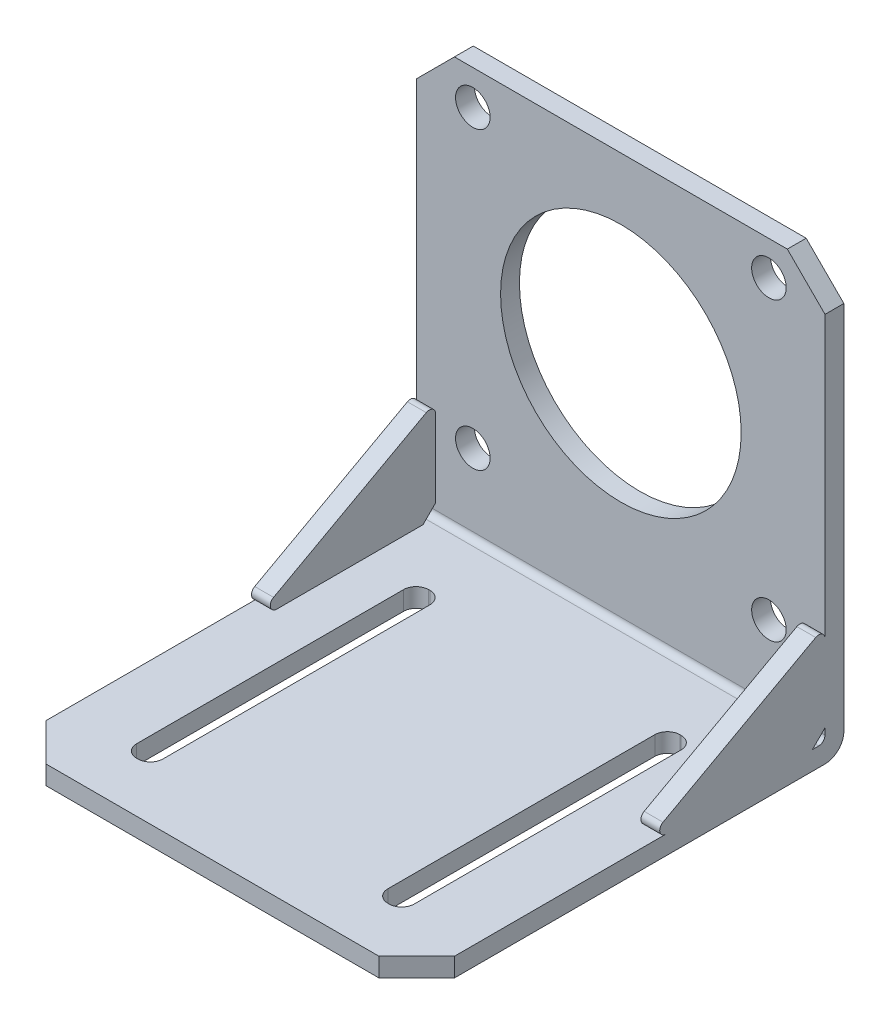
from build123d import *

# Parameters (mm, degrees)
SKETCH_1_W          = 65
SKETCH_1_H          = 65
EXTRUDE_1_DEPTH     = 3
SKETCH_1_3_W        = 65
SKETCH_1_3_H        = 3
EXTRUDE_2_DEPTH     = 68
CHAMFER_1_SIZE      = 6
CUT_EXTRUDE_1_REACH = 103.51
SKETCH_3_R          = 19.15
SKETCH_3_R_2        = 2.75
FILLET_1_R          = 3
FILLET_2_R          = 1
EXTRUDE_3_DEPTH     = 3
EXTRUDE_START       = -65
EXTRUDE_4_DEPTH     = 3


with BuildPart() as part:
    # Эскиз1 → Бобышка-Вытянуть1 (new body)
    with BuildSketch(Plane(origin=(0, 0, 0), x_dir=(1, 0, 0), z_dir=(0, 1, 0))):
        with Locations((0, -1.5)):
            Rectangle(SKETCH_1_W, SKETCH_1_H)
        with BuildLine():
            Line((-20.1, 20.5), (-19.9, 20.5))
            ThreePointArc((-19.9, 20.5), (-18.485786438, 19.914213562), (-17.9, 18.5))
            Line((-17.9, 18.5), (-17.9, -24))
            ThreePointArc((-17.9, -24), (-18.485786438, -25.414213562), (-19.9, -26))
            Line((-19.9, -26), (-20.1, -26))
            ThreePointArc((-20.1, -26), (-21.514213562, -25.414213562), (-22.1, -24))
            Line((-22.1, -24), (-22.1, 18.5))
            ThreePointArc((-22.1, 18.5), (-21.514213562, 19.914213562), (-20.1, 20.5))
        make_face(mode=Mode.SUBTRACT)
        with BuildLine():
            ThreePointArc((20.1, 20.5), (21.514213562, 19.914213562), (22.1, 18.5))
            Line((22.1, 18.5), (22.1, -24))
            ThreePointArc((22.1, -24), (21.514213562, -25.414213562), (20.1, -26))
            Line((20.1, -26), (19.9, -26))
            ThreePointArc((19.9, -26), (18.485786438, -25.414213562), (17.9, -24))
            Line((17.9, -24), (17.9, 18.5))
            ThreePointArc((17.9, 18.5), (18.485786438, 19.914213562), (19.9, 20.5))
            Line((19.9, 20.5), (20.1, 20.5))
        make_face(mode=Mode.SUBTRACT)
    extrude(amount=EXTRUDE_1_DEPTH)

    # Эскиз1<3> → Бобышка-Вытянуть2 (add)
    with BuildSketch(Plane(origin=(0, 0, 0), x_dir=(1, 0, 0), z_dir=(0, 1, 0))):
        with Locations((0, 32.5)):
            Rectangle(SKETCH_1_3_W, SKETCH_1_3_H)
    extrude(amount=EXTRUDE_2_DEPTH)

    # Фаска1
    chamfer_1_edges = [part.edges().sort_by_distance(p)[0] for p in [
        (32.5, 68, -32.5),
        (-32.5, 68, -32.5),
        (32.5, 1.5, 34),
        (-32.5, 1.5, 34),
    ]]
    chamfer(chamfer_1_edges, length=CHAMFER_1_SIZE)

    # Эскиз3 → Вырез-Вытянуть1 (cut, up to next)
    with BuildSketch(Plane(origin=(0, 0, -34), x_dir=(-1, 0, 0), z_dir=(0, 0, -1)), mode=Mode.PRIVATE) as cut_extrude_1_sk1:
        with Locations((0, 39)):
            Circle(SKETCH_3_R)
    cut_extrude_1_tool1 = extrude(cut_extrude_1_sk1.sketch, amount=-CUT_EXTRUDE_1_REACH, mode=Mode.PRIVATE) & part.part
    # Эскиз3 → Вырез-Вытянуть1 (cut, up to next)
    with BuildSketch(Plane(origin=(0, 0, -34), x_dir=(-1, 0, 0), z_dir=(0, 0, -1)), mode=Mode.PRIVATE) as cut_extrude_1_sk2:
        with Locations((-23.57, 62.57)):
            Circle(SKETCH_3_R_2)
    cut_extrude_1_tool2 = extrude(cut_extrude_1_sk2.sketch, amount=-CUT_EXTRUDE_1_REACH, mode=Mode.PRIVATE) & part.part
    # Эскиз3 → Вырез-Вытянуть1 (cut, up to next)
    with BuildSketch(Plane(origin=(0, 0, -34), x_dir=(-1, 0, 0), z_dir=(0, 0, -1)), mode=Mode.PRIVATE) as cut_extrude_1_sk3:
        with Locations((23.57, 62.5)):
            Circle(SKETCH_3_R_2)
    cut_extrude_1_tool3 = extrude(cut_extrude_1_sk3.sketch, amount=-CUT_EXTRUDE_1_REACH, mode=Mode.PRIVATE) & part.part
    # Эскиз3 → Вырез-Вытянуть1 (cut, up to next)
    with BuildSketch(Plane(origin=(0, 0, -34), x_dir=(-1, 0, 0), z_dir=(0, 0, -1)), mode=Mode.PRIVATE) as cut_extrude_1_sk4:
        with Locations((23.57, 15.5)):
            Circle(SKETCH_3_R_2)
    cut_extrude_1_tool4 = extrude(cut_extrude_1_sk4.sketch, amount=-CUT_EXTRUDE_1_REACH, mode=Mode.PRIVATE) & part.part
    # Эскиз3 → Вырез-Вытянуть1 (cut, up to next)
    with BuildSketch(Plane(origin=(0, 0, -34), x_dir=(-1, 0, 0), z_dir=(0, 0, -1)), mode=Mode.PRIVATE) as cut_extrude_1_sk5:
        with Locations((-23.57, 15.43)):
            Circle(SKETCH_3_R_2)
    cut_extrude_1_tool5 = extrude(cut_extrude_1_sk5.sketch, amount=-CUT_EXTRUDE_1_REACH, mode=Mode.PRIVATE) & part.part
    add(cut_extrude_1_tool1.solids().sort_by_distance((0, 39, -34))[0], mode=Mode.SUBTRACT)
    add(cut_extrude_1_tool2.solids().sort_by_distance((23.57, 62.57, -34))[0], mode=Mode.SUBTRACT)
    add(cut_extrude_1_tool3.solids().sort_by_distance((-23.57, 62.5, -34))[0], mode=Mode.SUBTRACT)
    add(cut_extrude_1_tool4.solids().sort_by_distance((-23.57, 15.5, -34))[0], mode=Mode.SUBTRACT)
    add(cut_extrude_1_tool5.solids().sort_by_distance((23.57, 15.43, -34))[0], mode=Mode.SUBTRACT)

    # Скругление1
    fillet_1_edges = [part.edges().sort_by_distance(p)[0] for p in [
        (0, 0, -34),
    ]]
    fillet(fillet_1_edges, radius=FILLET_1_R)

    # Скругление2
    fillet_2_edges = [part.edges().sort_by_distance(p)[0] for p in [
        (0, 3, -31),
    ]]
    fillet(fillet_2_edges, radius=FILLET_2_R)

    # Эскиз5 → Бобышка-Вытянуть3 (add)
    with BuildSketch(Plane.ZY.offset(32.5)):
        with BuildLine():
            Line((-31, 5), (-31, 17.312374786))
            ThreePointArc((-31, 17.312374786), (-30.509774395, 18.172682908), (-29.519739868, 18.189500891))
            Line((-29.519739868, 18.189500891), (-5.206600655, 4.877126106))
            ThreePointArc((-5.206600655, 4.877126106), (-4.718066148, 3.752135224), (-5.686860788, 3))
            Line((-5.686860788, 3), (-29, 3))
            Line((-29, 3), (-31, 5))
        make_face()
    extrude(amount=-EXTRUDE_3_DEPTH)

    # Эскиз5<2> → Бобышка-Вытянуть4 (add)
    with BuildSketch(Plane.ZY.offset(32.5).offset(EXTRUDE_START)):
        with BuildLine():
            Line((-31, 5), (-31, 17.312374786))
            ThreePointArc((-31, 17.312374786), (-30.509774395, 18.172682908), (-29.519739868, 18.189500891))
            Line((-29.519739868, 18.189500891), (-5.206600655, 4.877126106))
            ThreePointArc((-5.206600655, 4.877126106), (-4.718066148, 3.752135224), (-5.686860788, 3))
            Line((-5.686860788, 3), (-29, 3))
            Line((-29, 3), (-31, 5))
        make_face()
    extrude(amount=EXTRUDE_4_DEPTH)


solid = part.part
